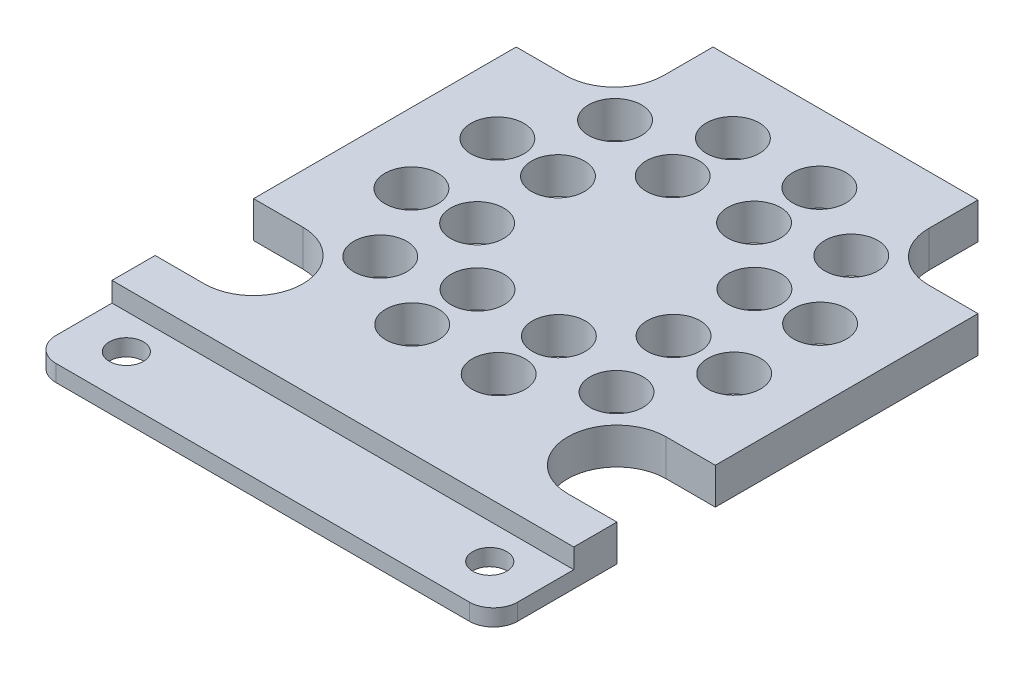
from build123d import *

# Parameters (mm, degrees)
BOSS_EXTRUDE1_DEPTH      = 2.4
BOSS_EXTRUDE2_DEPTH      = 2.2
BOSS_EXTRUDE2_DEPTH_BACK = 2.2
SKETCH3_R                = 1.125
CUT_EXTRUDE1_DEPTH       = 27.620762574
SKETCH4_W                = 5.3
SKETCH4_H                = 1.3
CUT_EXTRUDE2_DEPTH       = 38.364588851
FILLET1_R                = 1.6
FILLET2_R                = 0.25
FILLET3_R                = 1
SKETCH5_R                = 1.75
CUT_EXTRUDE3_DEPTH       = 27.620762574


with BuildPart() as part:
    # Sketch1 → Boss-Extrude1 (new body)
    with BuildSketch(Plane(origin=(0, 0, 0), x_dir=(1, 0, 0), z_dir=(0, 1, 0))):
        with BuildLine():
            Line((-8.75, 16), (-8.75, 19.25))
            Line((-8.75, 19.25), (8.75, 19.25))
            Line((8.75, 19.25), (8.75, 16))
            ThreePointArc((8.75, 16), (9.701902961, 13.701902961), (12, 12.75))
            Line((12, 12.75), (15.25, 12.75))
            Line((15.25, 12.75), (15.25, -4.6))
            Line((15.25, -4.6), (12, -4.6))
            ThreePointArc((12, -4.6), (8.75, -7.85), (12, -11.1))
            Line((12, -11.1), (15.25, -11.1))
            Line((15.25, -11.1), (15.25, -19.25))
            Line((15.25, -19.25), (-15.25, -19.25))
            Line((-15.25, -19.25), (-15.25, -11.1))
            Line((-15.25, -11.1), (-12, -11.1))
            ThreePointArc((-12, -11.1), (-8.75, -7.85), (-12, -4.6))
            Line((-12, -4.6), (-15.25, -4.6))
            Line((-15.25, -4.6), (-15.25, 12.75))
            Line((-15.25, 12.75), (-12, 12.75))
            ThreePointArc((-12, 12.75), (-9.701902961, 13.701902961), (-8.75, 16))
        make_face()
    extrude(amount=BOSS_EXTRUDE1_DEPTH)

    # Sketch2 → Boss-Extrude2 (add, two sides: drawn at the far end of the back side and taken through both)
    with BuildSketch(Plane(origin=(0, 0, -19.25), x_dir=(-1, 0, 0), z_dir=(0, 0, -1)).offset(-BOSS_EXTRUDE2_DEPTH_BACK)):
        Polygon((0, 0), (5.75, 0), (5.75, -1.6), (-5.75, -1.6), (-5.75, 0), align=None)
    extrude(amount=BOSS_EXTRUDE2_DEPTH + BOSS_EXTRUDE2_DEPTH_BACK)

    # Sketch3 → Cut-Extrude1 (cut, through all)
    with BuildSketch(Plane(origin=(0, 2.4, 0), x_dir=(1, 0, 0), z_dir=(0, 1, 0))):
        with Locations(Location((-12, -16.25, 0), (0, 0, 270))):
            Circle(SKETCH3_R)
        with Locations(Location((12, -16.25, 0), (0, 0, 270))):
            Circle(SKETCH3_R)
    extrude(amount=-CUT_EXTRUDE1_DEPTH, mode=Mode.SUBTRACT)

    # Sketch4 → Cut-Extrude2 (cut, through all)
    with BuildSketch(Plane.ZY.offset(15.25)):
        with Locations((16.6, 1.75)):
            Rectangle(SKETCH4_W, SKETCH4_H)
    extrude(amount=-CUT_EXTRUDE2_DEPTH, mode=Mode.SUBTRACT)

    # Fillet1
    fillet1_edges = [part.edges().sort_by_distance(p)[0] for p in [
        (15.25, 0.55, 19.25),
        (-15.25, 0.55, 19.25),
    ]]
    fillet(fillet1_edges, radius=FILLET1_R)

    # Fillet2
    fillet2_edges = [part.edges().sort_by_distance(p)[0] for p in [
        (0, 0, -19.25),
    ]]
    fillet(fillet2_edges, radius=FILLET2_R)

    # Fillet3
    fillet3_edges = [part.edges().sort_by_distance(p)[0] for p in [
        (0, 0, -17.05),
    ]]
    fillet(fillet3_edges, radius=FILLET3_R)

    # Sketch5 → Cut-Extrude3 (cut, through all)
    with BuildSketch(Plane(origin=(0, 2.4, 0), x_dir=(1, 0, 0), z_dir=(0, 1, 0))):
        with Locations(Location((-6.475522352, 6.733497746, 0), (0, 0, 270))):
            Circle(SKETCH5_R)
        with Locations(Location((-10.634056634, 6.888687884, 0), (0, 0, 270))):
            Circle(SKETCH5_R)
        with Locations(Location((-7.802519248, 11.828753503, 0), (0, 0, 270))):
            Circle(SKETCH5_R)
        with Locations(Location((-6.458727551, 1.375956017, 0), (0, 0, 270))):
            Circle(SKETCH5_R)
        with Locations(Location((-2.658497746, -2.400522352, 0), (0, 0, 270))):
            Circle(SKETCH5_R)
        with Locations(Location((2.699043983, -2.383727551, 0), (0, 0, 270))):
            Circle(SKETCH5_R)
        with Locations(Location((6.475522352, 1.416502254, 0), (0, 0, 270))):
            Circle(SKETCH5_R)
        with Locations(Location((6.458727551, 6.774043983, 0), (0, 0, 270))):
            Circle(SKETCH5_R)
        with Locations(Location((2.658497746, 10.550522352, 0), (0, 0, 270))):
            Circle(SKETCH5_R)
        with Locations(Location((-2.699043983, 10.533727551, 0), (0, 0, 270))):
            Circle(SKETCH5_R)
        with Locations(Location((-2.880303131, 14.691207132, 0), (0, 0, 270))):
            Circle(SKETCH5_R)
        with Locations(Location((2.813687884, 14.709056634, 0), (0, 0, 270))):
            Circle(SKETCH5_R)
        with Locations(Location((7.753753503, 11.877519248, 0), (0, 0, 270))):
            Circle(SKETCH5_R)
        with Locations(Location((10.616207132, 6.955303131, 0), (0, 0, 270))):
            Circle(SKETCH5_R)
        with Locations(Location((10.634056634, 1.261312116, 0), (0, 0, 270))):
            Circle(SKETCH5_R)
        with Locations(Location((7.802519248, -3.678753503, 0), (0, 0, 270))):
            Circle(SKETCH5_R)
        with Locations(Location((2.880303131, -6.541207132, 0), (0, 0, 270))):
            Circle(SKETCH5_R)
        with Locations(Location((-2.813687884, -6.559056634, 0), (0, 0, 270))):
            Circle(SKETCH5_R)
        with Locations(Location((-7.753753503, -3.727519248, 0), (0, 0, 270))):
            Circle(SKETCH5_R)
        with Locations(Location((-10.616207132, 1.194696869, 0), (0, 0, 270))):
            Circle(SKETCH5_R)
    extrude(amount=-CUT_EXTRUDE3_DEPTH, mode=Mode.SUBTRACT)


solid = part.part
